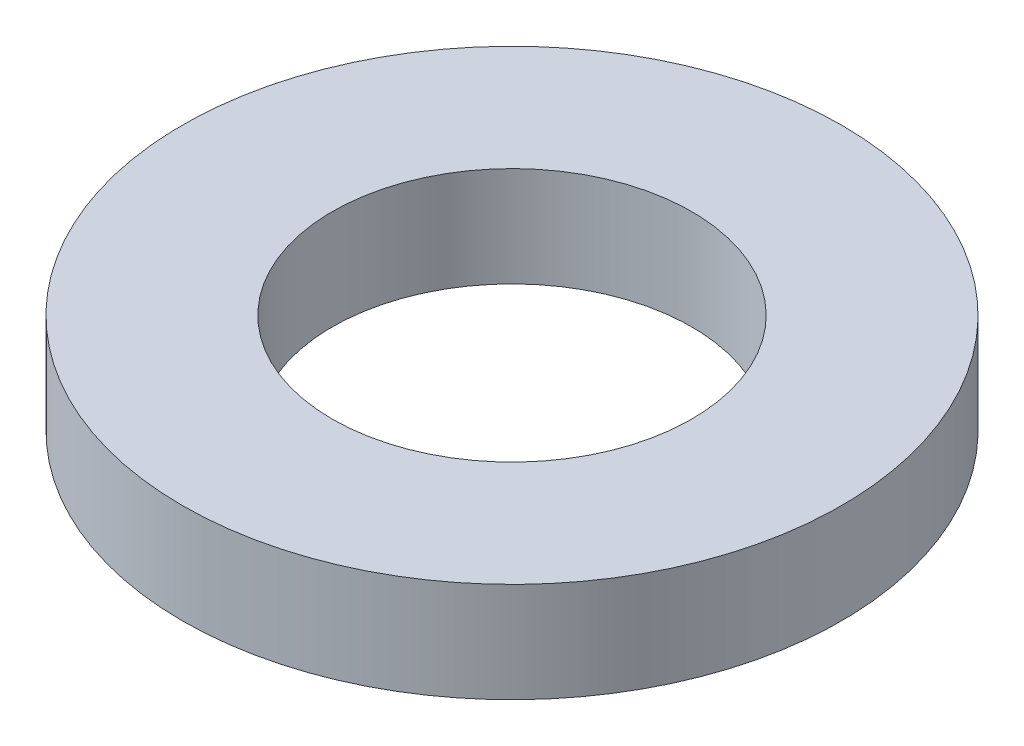
from build123d import *

# Parameters (mm, degrees)
SKETCH1_R           = 3.3
SKETCH1_R_2         = 1.8
BOSS_EXTRUDE1_DEPTH = 1


with BuildPart() as part:
    # Sketch1 → Boss-Extrude1 (new body)
    with BuildSketch(Plane(origin=(0, 0, 0), x_dir=(1, 0, 0), z_dir=(0, 1, 0))):
        with Locations(Location((0, 0, 0), (0, 0, 270))):
            Circle(SKETCH1_R)
        with Locations(Location((0, 0, 0), (0, 0, 270))):
            Circle(SKETCH1_R_2, mode=Mode.SUBTRACT)
    extrude(amount=BOSS_EXTRUDE1_DEPTH)


solid = part.part
